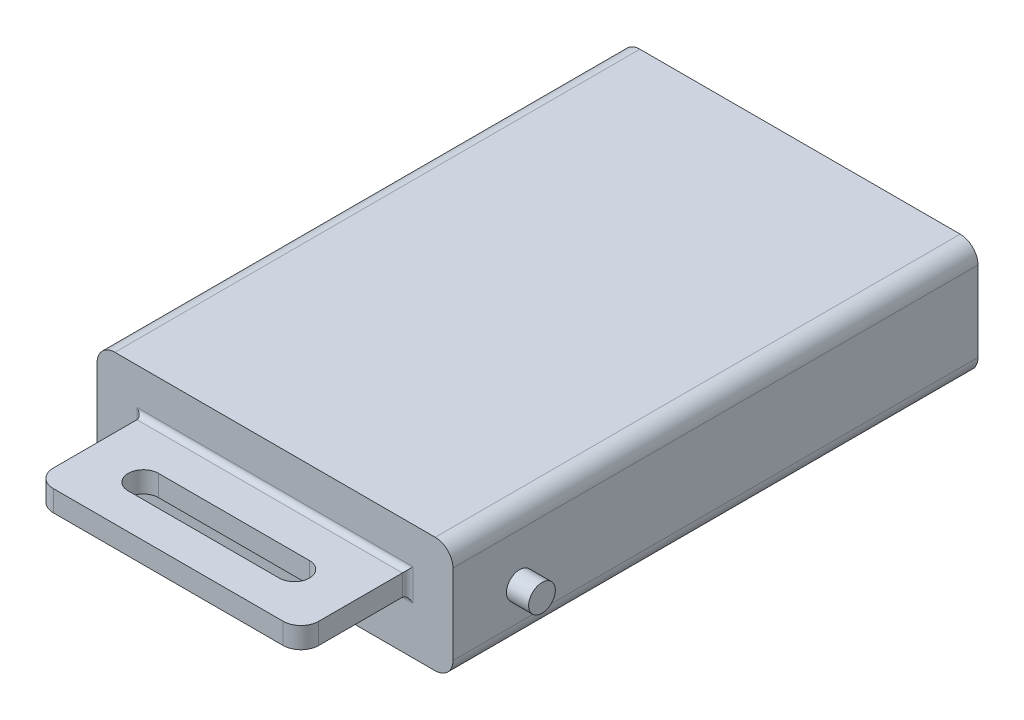
from build123d import *

# Parameters (mm, degrees)
EXTRUDE1_DEPTH = 74.93
SKETCH2_R      = 1.905
EXTRUDE2_DEPTH = 3.175
SKETCH3_W      = 37.880364804
SKETCH3_H      = 3.00059593
EXTRUDE3_DEPTH = 15.24
FILLET1_R      = 2.54
FILLET2_R      = 0.762
EXTRUDE4_DEPTH = 17.78
SKETCH5_W      = 39.584129336
SKETCH5_H      = 3.52111337
EXTRUDE5_DEPTH = 17.78


with BuildPart() as part:
    # Sketch1 → Extrude1 (new body)
    with BuildSketch(Plane.XY):
        with BuildLine():
            Line((2.54, 0), (48.26, 0))
            ThreePointArc((48.26, 0), (50.056051224, 0.743948776), (50.8, 2.54))
            Line((50.8, 2.54), (50.8, 13.97))
            ThreePointArc((50.8, 13.97), (50.056051224, 15.766051224), (48.26, 16.51))
            Line((48.26, 16.51), (2.54, 16.51))
            ThreePointArc((2.54, 16.51), (0.743948776, 15.766051224), (0, 13.97))
            Line((0, 13.97), (0, 2.54))
            ThreePointArc((0, 2.54), (0.743948776, 0.743948776), (2.54, 0))
        make_face()
    extrude(amount=-EXTRUDE1_DEPTH)

    # Sketch2 → Extrude2 (add)
    with BuildSketch(Plane(origin=(0, 0, 0), x_dir=(0, 0, -1), z_dir=(1, 0, 0))):
        with Locations((9.525, 7.112)):
            Circle(SKETCH2_R)
    extrude2 = extrude(amount=-EXTRUDE2_DEPTH)

    # Mirror1: Extrude2 across plane
    add(extrude2.mirror(Plane(origin=(25.4, 0, 0), x_dir=(0, 0, 1), z_dir=(1, 0, 0))))

    # Sketch3 → Extrude3 (add)
    with BuildSketch(Plane.XY):
        with Locations((25.4, 9.017)):
            Rectangle(SKETCH3_W, SKETCH3_H)
    extrude(amount=EXTRUDE3_DEPTH)

    # Fillet1
    fillet1_edges = [part.edges().sort_by_distance(p)[0] for p in [
        (44.340182402, 9.017, 15.24),
        (6.459817598, 9.017, 15.24),
    ]]
    fillet(fillet1_edges, radius=FILLET1_R)

    # Fillet2
    fillet2_edges = [part.edges().sort_by_distance(p)[0] for p in [
        (44.340182402, 9.017, 0),
        (25.4, 10.517297965, 0),
        (6.459817598, 9.017, 0),
        (25.4, 7.516702035, 0),
    ]]
    fillet(fillet2_edges, radius=FILLET2_R)

    # Sketch4 → Extrude4 (cut)
    with BuildSketch(Plane(origin=(0, 10.517297965, 0), x_dir=(-1, 0, 0), z_dir=(0, 1, 0))):
        with BuildLine():
            Line((-36.179236435, 10.183663009), (-14.620763565, 10.183663009))
            ThreePointArc((-14.620763565, 10.183663009), (-12.457260283, 8.020159727), (-14.620763565, 5.856656445))
            Line((-14.620763565, 5.856656445), (-36.179236435, 5.856656445))
            ThreePointArc((-36.179236435, 5.856656445), (-38.342739717, 8.020159727), (-36.179236435, 10.183663009))
        make_face()
    extrude(amount=-EXTRUDE4_DEPTH, mode=Mode.SUBTRACT)

    # Sketch5 → Extrude5 (cut)
    with BuildSketch(Plane(origin=(0, 0, -74.93), x_dir=(-1, 0, 0), z_dir=(0, 0, -1))):
        with Locations((-25.4, 8.255)):
            Rectangle(SKETCH5_W, SKETCH5_H)
    extrude(amount=-EXTRUDE5_DEPTH, mode=Mode.SUBTRACT)


solid = part.part
